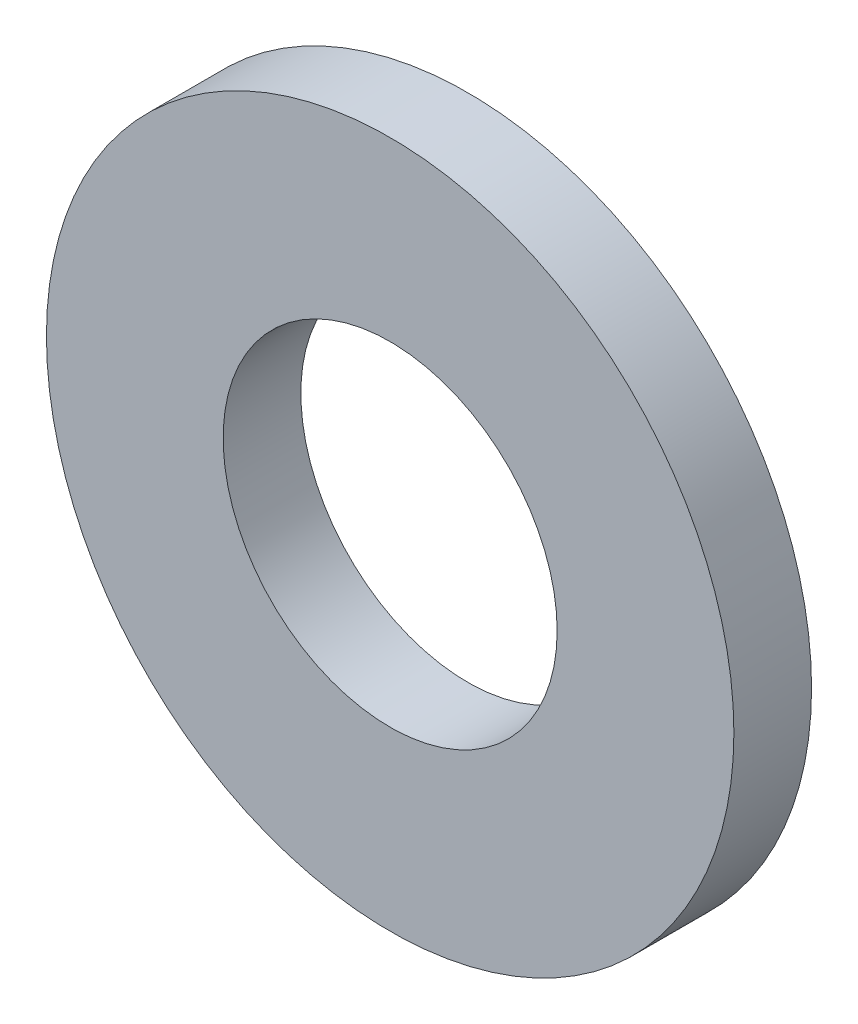
from build123d import *

# Parameters (mm, degrees)
SKETCH1_R           = 4.425
SKETCH1_R_2         = 2.15
BOSS_EXTRUDE1_DEPTH = 1


with BuildPart() as part:
    # Sketch1 → Boss-Extrude1 (new body)
    with BuildSketch(Plane.XY):
        Circle(SKETCH1_R)
        Circle(SKETCH1_R_2, mode=Mode.SUBTRACT)
    extrude(amount=BOSS_EXTRUDE1_DEPTH)


solid = part.part
